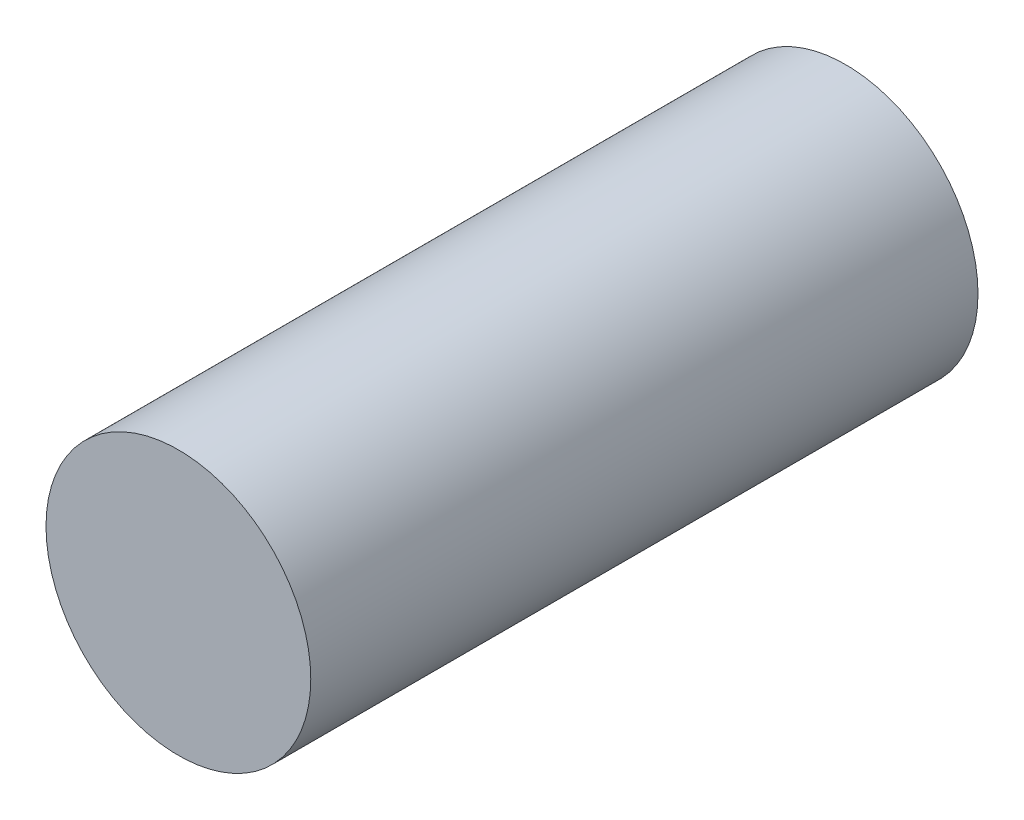
from build123d import *

# Parameters (mm, degrees)
SKETCH1_R           = 0.25
BOSS_EXTRUDE1_DEPTH = 1.26


with BuildPart() as part:
    # Sketch1 → Boss-Extrude1 (new body)
    with BuildSketch(Plane.XY):
        with Locations((5.435663308, 11.960210024)):
            Circle(SKETCH1_R)
    extrude(amount=BOSS_EXTRUDE1_DEPTH)


solid = part.part
